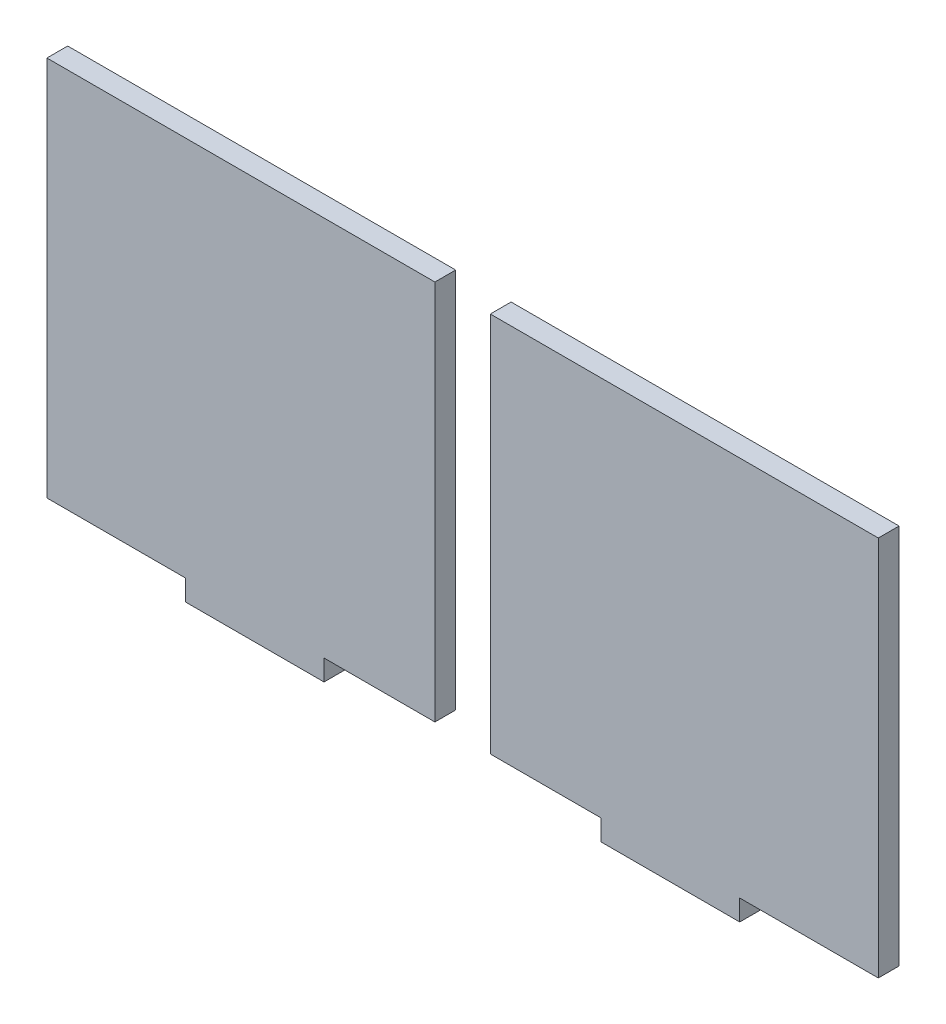
from build123d import *

# Parameters (mm, degrees)
SKETCH1_W             = 56
SKETCH1_H             = 55
BOSS_EXTRUDE1_DEPTH   = 3
BOSS_EXTRUDE1_2_DEPTH = 3
SKETCH2_W             = 20
SKETCH2_H             = 3
BOSS_EXTRUDE2_DEPTH   = 3


with BuildPart() as part:
    # Sketch1 → Boss-Extrude1 (new body)
    with BuildSketch(Plane.XY):
        with Locations((28, 27.5)):
            Rectangle(SKETCH1_W, SKETCH1_H)
    extrude(amount=-BOSS_EXTRUDE1_DEPTH)



with BuildPart() as body_2:
    # Sketch1 → Boss-Extrude1 2 (new body)
    with BuildSketch(Plane.XY):
        with Locations((92, 27.5)):
            Rectangle(SKETCH1_W, SKETCH1_H)
    extrude(amount=-BOSS_EXTRUDE1_2_DEPTH)


with BuildPart() as part_1:
    add(part.part)

    add(body_2.part)  # Boss-Extrude2 merges body 2
    # Sketch2 → Boss-Extrude2 (add)
    with BuildSketch(Plane.XY):
        with Locations((30, -1.5)):
            Rectangle(SKETCH2_W, SKETCH2_H)
        with Locations((90, -1.5)):
            Rectangle(SKETCH2_W, SKETCH2_H)
    extrude(amount=-BOSS_EXTRUDE2_DEPTH)


solid = part_1.part
